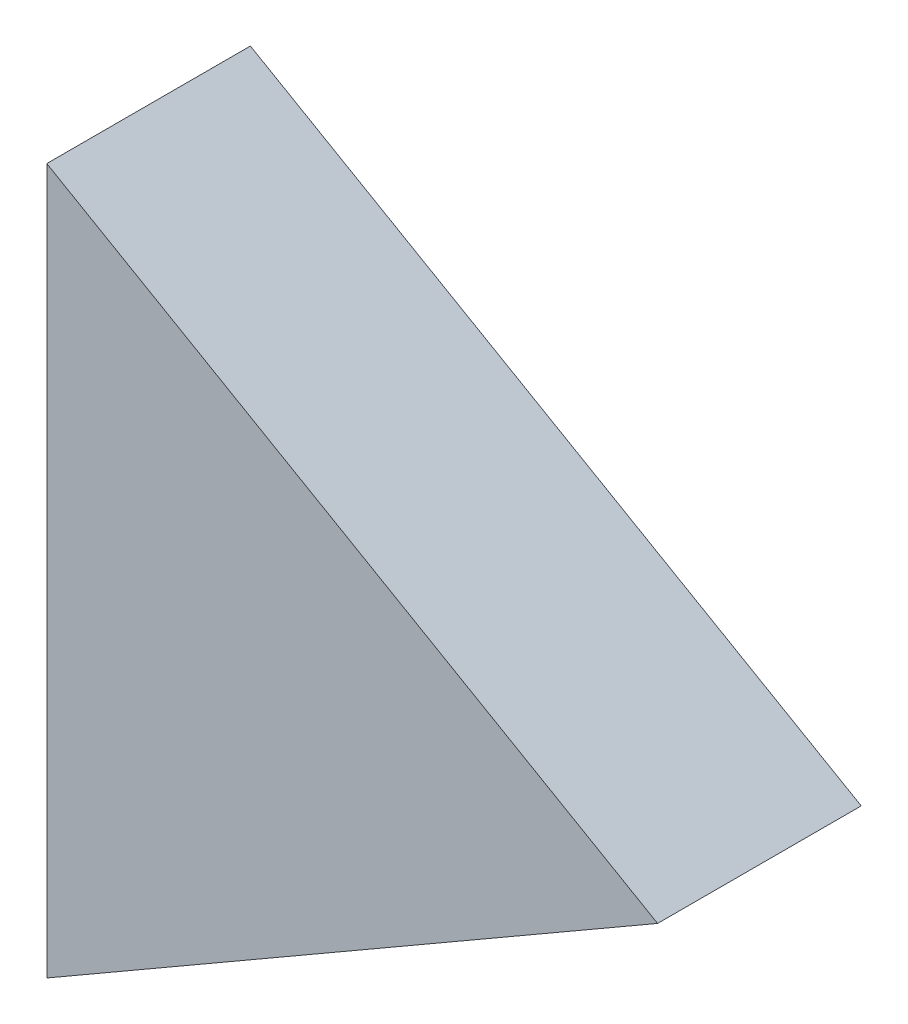
from build123d import *

# Parameters (mm, degrees)
EXTRUDE_1_DEPTH = 50


with BuildPart() as part:
    # 草图1 → 凸台-拉伸1 (new, symmetric)
    with BuildSketch(Plane.XY):
        Polygon((200, 0), (-100, 173.205080757), (-100, -173.205080757), align=None)
    extrude(amount=EXTRUDE_1_DEPTH, both=True)


solid = part.part
